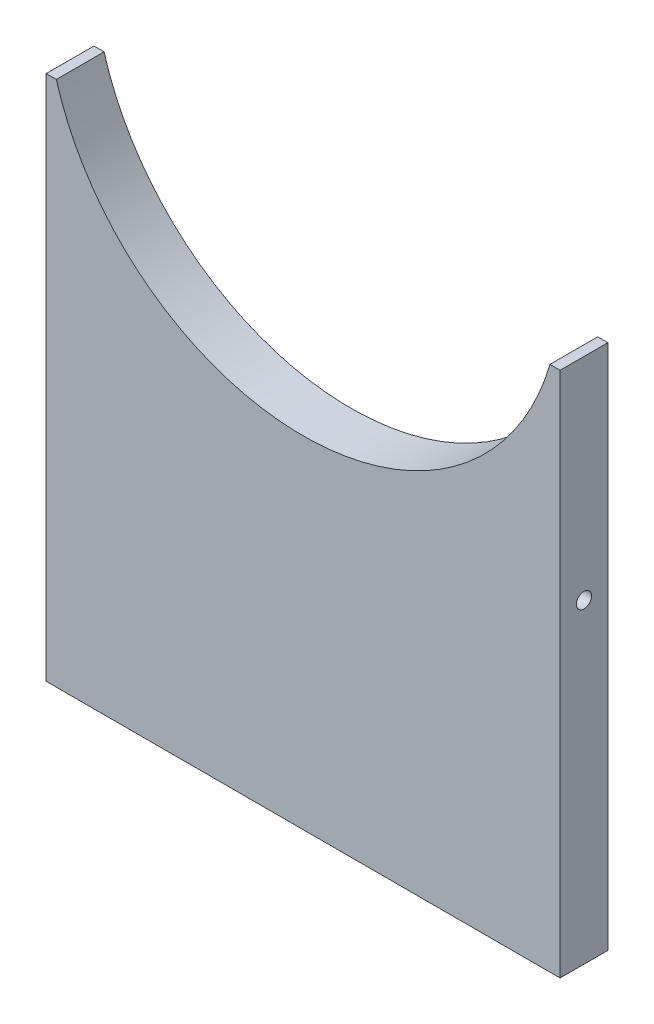
from build123d import *

# Parameters (mm, degrees)
BOSS_EXTRUDE1_DEPTH        = 12.7
F_10_32_TAPPED_HOLE2_D     = 4.0386
F_10_32_TAPPED_HOLE2_DEPTH = 25.4
F_10_32_TAPPED_HOLE2_TIP   = 1.213317848


with BuildPart() as part:
    # Sketch1 → Boss-Extrude1 (new body)
    with BuildSketch(Plane.XY):
        with BuildLine():
            Line((0, 0), (0, 140))
            Line((0, 140), (2.7, 140))
            ThreePointArc((2.7, 140), (68.35, 90.722783973), (134, 140))
            Line((134, 140), (136.7, 140))
            Line((136.7, 140), (136.7, 0))
            Line((136.7, 0), (0, 0))
        make_face()
    extrude(amount=BOSS_EXTRUDE1_DEPTH)

    # Sketch3 → #10-32 Tapped Hole1 (revolve, cut)
    with BuildSketch(Plane(origin=(136.7, 83.866, 6.35), x_dir=(0, 0, -1), z_dir=(0, 1, 0))):
        Polygon((0, 0), (0, 26.613317848), (2.0193, 25.4), (2.0193, 0), align=None)
    f_10_32_tapped_hole1 = revolve(axis=Axis((143.05, 83.866, 6.35), (-1, 0, 0)), mode=Mode.SUBTRACT)

    # Mirror3: #10-32 Tapped Hole1 across plane
    add(f_10_32_tapped_hole1.mirror(Plane(origin=(68.35, 0, 0), x_dir=(0, 0, 1), z_dir=(1, 0, 0))), mode=Mode.SUBTRACT)

    # #10-32 Tapped Hole2
    with Locations(Plane(origin=(112.35, 0, 6.35), x_dir=(0, 0, -1), z_dir=(0, -1, 0))):
        with Locations((0, 0), (0, -88)):
            Hole(F_10_32_TAPPED_HOLE2_D / 2, depth=F_10_32_TAPPED_HOLE2_DEPTH)
            with Locations((0, 0, -(F_10_32_TAPPED_HOLE2_DEPTH + F_10_32_TAPPED_HOLE2_TIP / 2))):  # 118° drill point
                Cone(0, F_10_32_TAPPED_HOLE2_D / 2, F_10_32_TAPPED_HOLE2_TIP, mode=Mode.SUBTRACT)


solid = part.part
